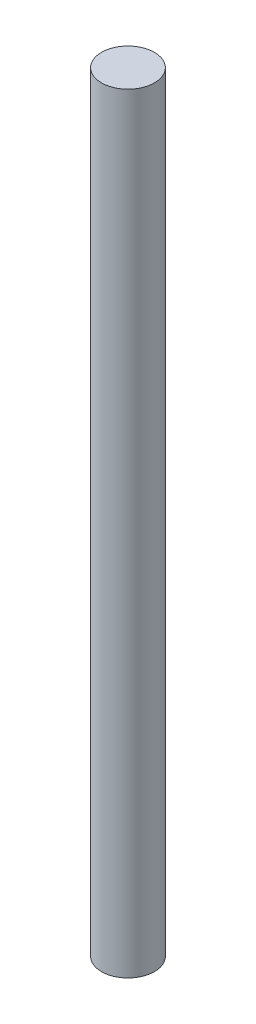
from build123d import *

# Parameters (mm, degrees)
SKETCH_2_R      = 2
EXTRUDE_1_DEPTH = 58.18


with BuildPart() as part:
    # 草图2 → 凸台-拉伸1 (new body)
    with BuildSketch(Plane(origin=(0, 0, 0), x_dir=(1, 0, 0), z_dir=(0, 1, 0))):
        with Locations(Location((0, 0, 0), (0, 0, 270))):
            Circle(SKETCH_2_R)
    extrude(amount=EXTRUDE_1_DEPTH)


solid = part.part
